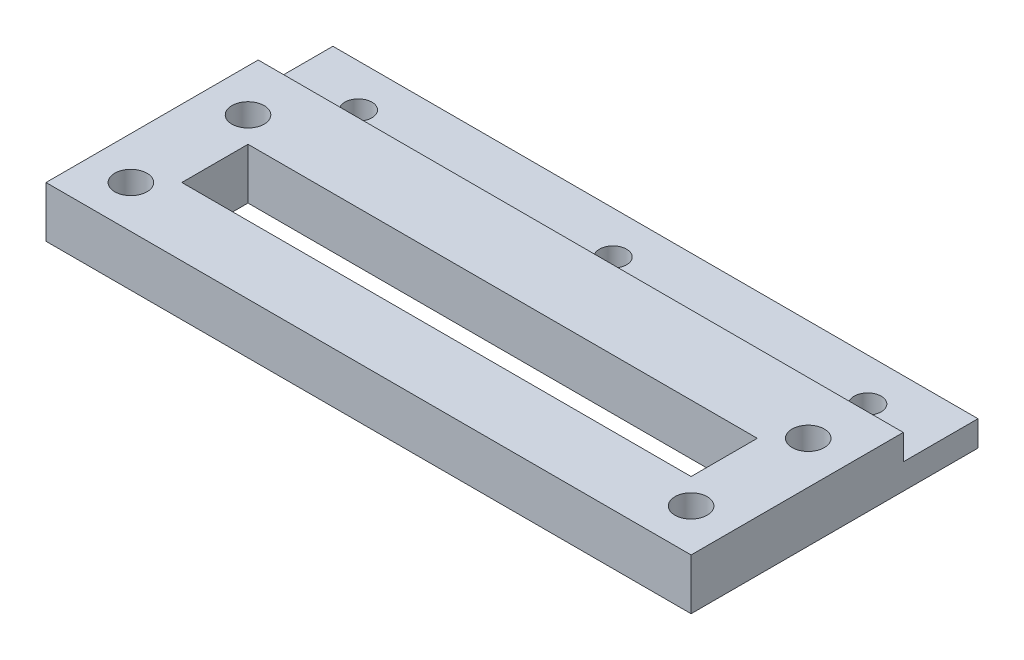
from build123d import *

# Parameters (mm, degrees)
SKETCH_1_W          = 76
SKETCH_1_H          = 23.8
SKETCH_1_R          = 1.9
EXTRUDE_1_DEPTH     = 3
SKETCH_3_W          = 76
SKETCH_3_H          = 3
EXTRUDE_2_DEPTH     = 10
SKETCH_4_R          = 1.6
CUT_EXTRUDE_1_DEPTH = 10
SKETCH_5_W          = 60
SKETCH_5_H          = 7.8
CUT_EXTRUDE_2_DEPTH = 10
SKETCH_6_W          = 76
SKETCH_6_H          = 25
SKETCH_6_R          = 1.9
SKETCH_6_W_2        = 60
SKETCH_6_H_2        = 7.8
EXTRUDE_3_DEPTH     = 3


with BuildPart() as part:
    # 草图1 → 凸台-拉伸1 (new body)
    with BuildSketch(Plane(origin=(0, 0, 0), x_dir=(1, 0, 0), z_dir=(0, 1, 0))):
        with Locations((33, -6.9)):
            Rectangle(SKETCH_1_W, SKETCH_1_H)
        Circle(SKETCH_1_R, mode=Mode.SUBTRACT)
        with Locations((0, -13.8)):
            Circle(SKETCH_1_R, mode=Mode.SUBTRACT)
        with Locations((66, -13.8)):
            Circle(SKETCH_1_R, mode=Mode.SUBTRACT)
        with Locations((66, 0)):
            Circle(SKETCH_1_R, mode=Mode.SUBTRACT)
    extrude(amount=EXTRUDE_1_DEPTH)

    # 草图3 → 凸台-拉伸2 (add)
    with BuildSketch(Plane(origin=(0, 0, -5), x_dir=(-1, 0, 0), z_dir=(0, 0, -1))):
        with Locations((-33, 1.5)):
            Rectangle(SKETCH_3_W, SKETCH_3_H)
    extrude(amount=EXTRUDE_2_DEPTH)

    # 草图4 → 切除-拉伸1 (cut)
    with BuildSketch(Plane(origin=(0, 3, 0), x_dir=(1, 0, 0), z_dir=(0, 1, 0))):
        with Locations((3, 10)):
            Circle(SKETCH_4_R)
        with Locations((33, 10)):
            Circle(SKETCH_4_R)
        with Locations((63, 10)):
            Circle(SKETCH_4_R)
    extrude(amount=-CUT_EXTRUDE_1_DEPTH, mode=Mode.SUBTRACT)

    # 草图5 → 切除-拉伸2 (cut)
    with BuildSketch(Plane(origin=(0, 3, 0), x_dir=(1, 0, 0), z_dir=(0, 1, 0))):
        with Locations((33, -6.9)):
            Rectangle(SKETCH_5_W, SKETCH_5_H)
    extrude(amount=-CUT_EXTRUDE_2_DEPTH, mode=Mode.SUBTRACT)

    # 草图6 → 凸台-拉伸3 (add)
    with BuildSketch(Plane(origin=(0, 3, 0), x_dir=(1, 0, 0), z_dir=(0, 1, 0))):
        with Locations((33, -6.3)):
            Rectangle(SKETCH_6_W, SKETCH_6_H)
        with Locations((0, -13.8)):
            Circle(SKETCH_6_R, mode=Mode.SUBTRACT)
        with Locations((33, -6.9)):
            Rectangle(SKETCH_6_W_2, SKETCH_6_H_2, mode=Mode.SUBTRACT)
        with Locations((66, -13.8)):
            Circle(SKETCH_6_R, mode=Mode.SUBTRACT)
        Circle(SKETCH_6_R, mode=Mode.SUBTRACT)
        with Locations((66, 0)):
            Circle(SKETCH_6_R, mode=Mode.SUBTRACT)
    extrude(amount=EXTRUDE_3_DEPTH)


solid = part.part
